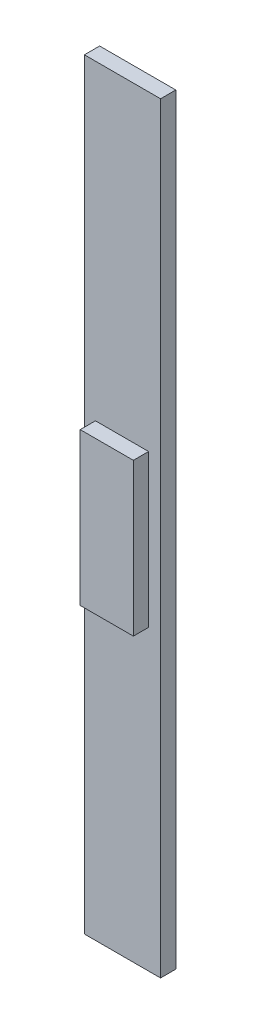
from build123d import *

# Parameters (mm, degrees)
SKETCH1_W           = 1270
SKETCH1_H           = 12700
BOSS_EXTRUDE1_DEPTH = 254
SKETCH2_W           = 886.249685286
SKETCH2_H           = 2540
BOSS_EXTRUDE2_DEPTH = 254


with BuildPart() as part:
    # Sketch1 → Boss-Extrude1 (new body)
    with BuildSketch(Plane.XY):
        with Locations((635, 6350)):
            Rectangle(SKETCH1_W, SKETCH1_H)
    extrude(amount=BOSS_EXTRUDE1_DEPTH)

    # Sketch2 → Boss-Extrude2 (add)
    with BuildSketch(Plane.XY.offset(254)):
        with Locations((627.248400955, 6235.095933428)):
            Rectangle(SKETCH2_W, SKETCH2_H)
    extrude(amount=BOSS_EXTRUDE2_DEPTH)


solid = part.part
